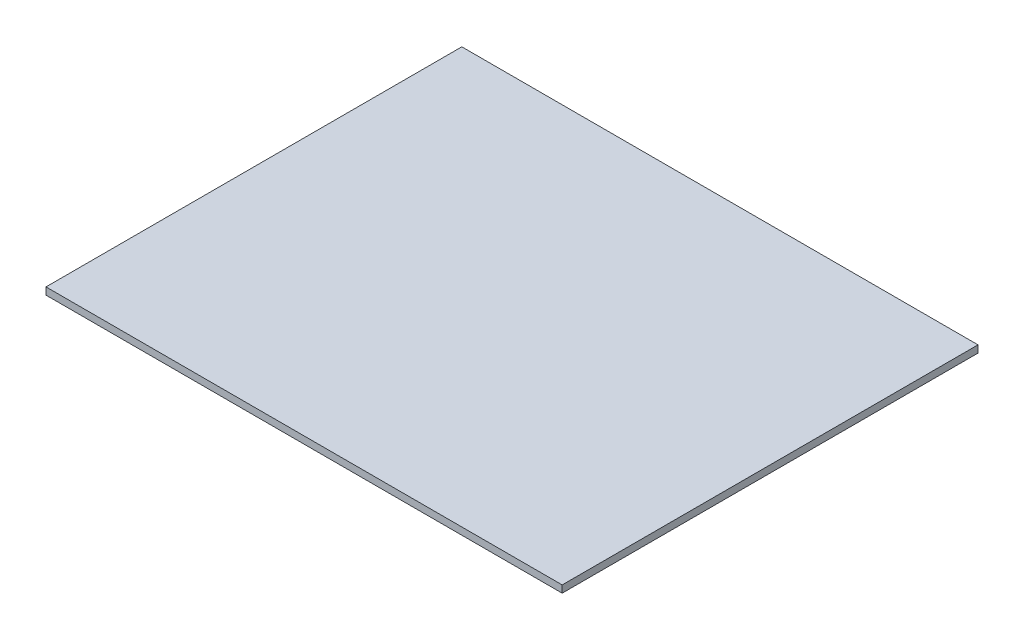
from build123d import *

# Parameters (mm, degrees)
ESBO_O2_W                = 360
ESBO_O2_H                = 290
RESSALTO_EXTRUS_O2_DEPTH = 5


with BuildPart() as part:
    # Esboço2 → Ressalto-extrusão2 (new body)
    with BuildSketch(Plane(origin=(0, 0, 0), x_dir=(1, 0, 0), z_dir=(0, 1, 0))):
        Rectangle(ESBO_O2_W, ESBO_O2_H)
    extrude(amount=RESSALTO_EXTRUS_O2_DEPTH)


solid = part.part
